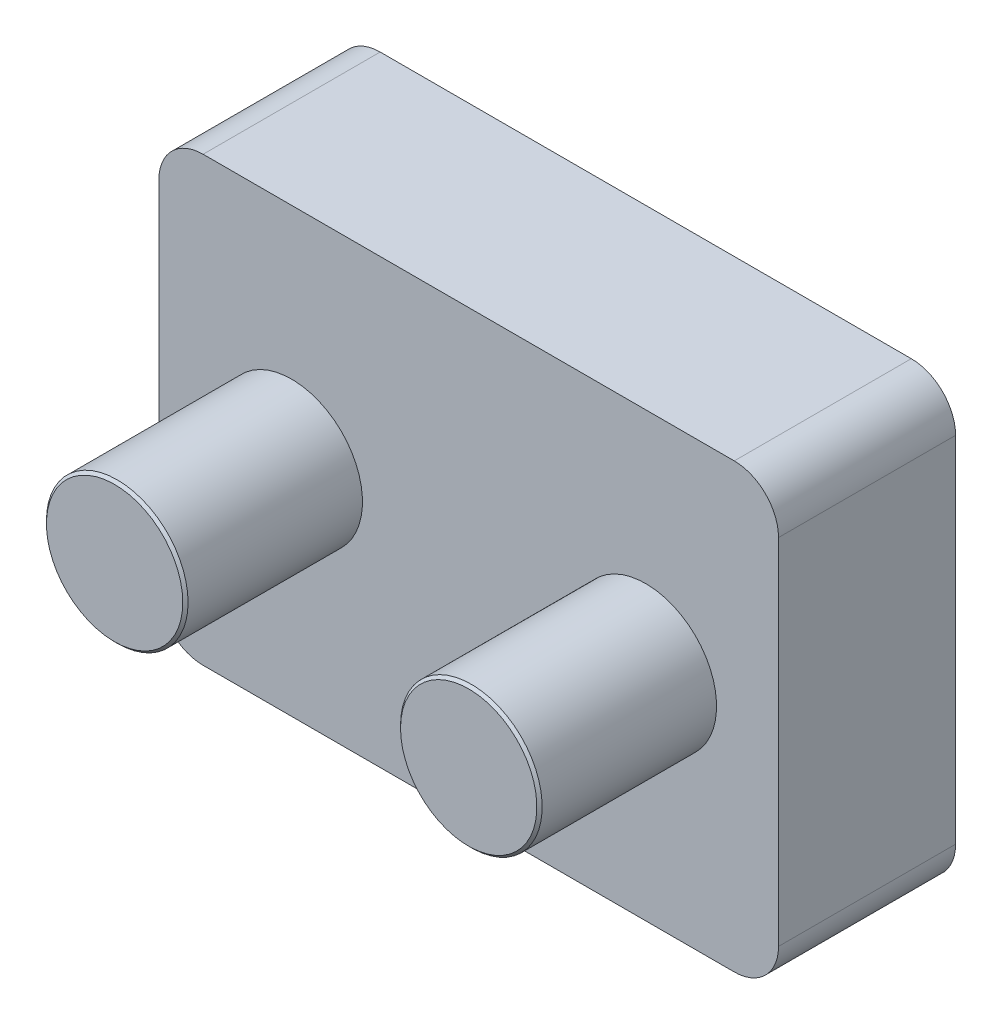
from build123d import *

# Parameters (mm, degrees)
SKETCH_1_W      = 70
SKETCH_1_H      = 50
EXTRUDE_1_DEPTH = 20
SKETCH_2_R      = 8
EXTRUDE_2_DEPTH = 20
CHAMFER_1_SIZE  = 0.3
FILLET_1_R      = 5


with BuildPart() as part:
    # Эскиз1 → Бобышка-Вытянуть1 (new body)
    with BuildSketch(Plane.XY):
        Rectangle(SKETCH_1_W, SKETCH_1_H)
    extrude(amount=EXTRUDE_1_DEPTH)

    # Эскиз2 → Бобышка-Вытянуть2 (add)
    with BuildSketch(Plane.XY.offset(20)):
        with Locations((-20, 0)):
            Circle(SKETCH_2_R)
        with Locations((20, 0)):
            Circle(SKETCH_2_R)
    extrude(amount=EXTRUDE_2_DEPTH)

    # Фаска1
    chamfer_1_edges = [part.edges().sort_by_distance(p)[0] for p in [
        (12, 0, 40),
        (-28, 0, 40),
    ]]
    chamfer(chamfer_1_edges, length=CHAMFER_1_SIZE)

    # Скругление1
    fillet_1_edges = [part.edges().sort_by_distance(p)[0] for p in [
        (-35, -25, 10),
        (35, -25, 10),
        (35, 25, 10),
        (-35, 25, 10),
    ]]
    fillet(fillet_1_edges, radius=FILLET_1_R)


solid = part.part
